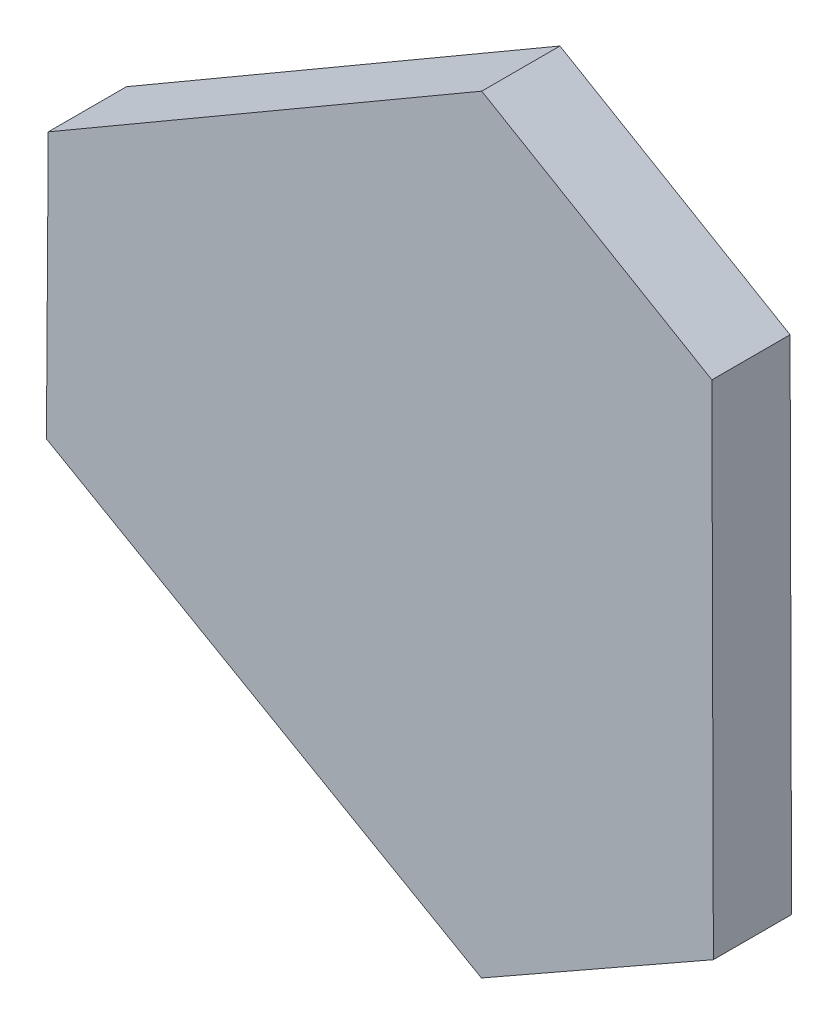
from build123d import *

# Parameters (mm, degrees)
EXTRUDE_1_DEPTH = 50


with BuildPart() as part:
    # 草图1 → 凸台-拉伸1 (new, symmetric)
    with BuildSketch(Plane.XY):
        Polygon((381.126409191, 319.803029384), (383.022221559, -321.393804843), (86.394343058, -489.966667104), (-469.846310393, -171.010071663), (-467.520752249, 170.16363772), (86.824088833, 492.403876506), align=None)
    extrude(amount=EXTRUDE_1_DEPTH, both=True)


solid = part.part
